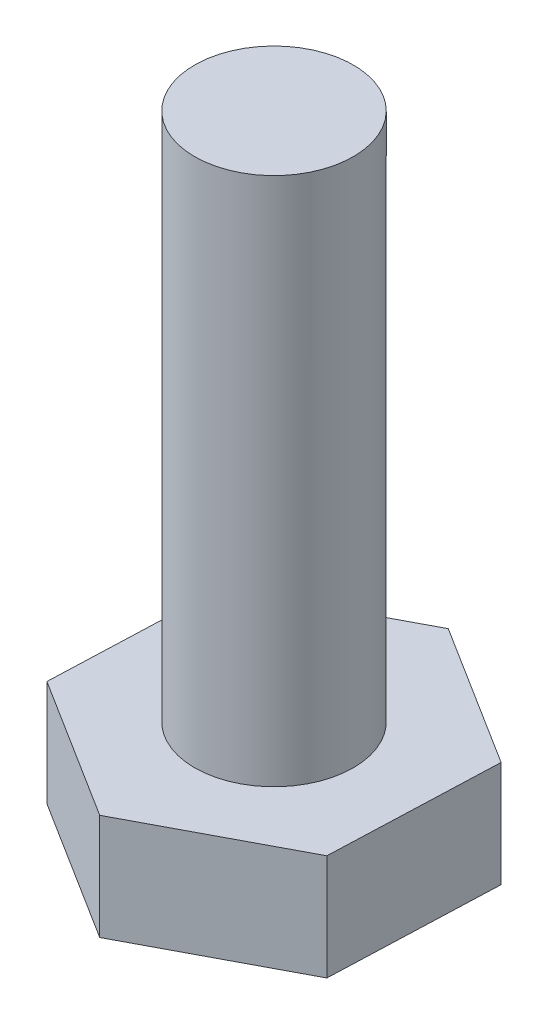
from build123d import *

# Parameters (mm, degrees)
BOSS_EXTRUDE1_DEPTH      = 8
BOSS_EXTRUDE1_DEPTH_BACK = 2
SKETCH1_R                = 1.5
SKETCH2_R                = 1.5
BOSS_EXTRUDE2_DEPTH      = 2
SKETCH5_R                = 1.5
BOSS_EXTRUDE3_DEPTH      = 2


with BuildPart() as part:
    # Sketch1 → Boss-Extrude1 (new, two sides: drawn at the far end of the back side and taken through both)
    with BuildSketch(Plane(origin=(0, 0, 0), x_dir=(1, 0, 0), z_dir=(0, 1, 0)).offset(-BOSS_EXTRUDE1_DEPTH_BACK)):
        with Locations(Location((-11.29860715, -4.069786589, 0), (0, 0, 270))):
            Circle(SKETCH1_R)
    extrude(amount=BOSS_EXTRUDE1_DEPTH + BOSS_EXTRUDE1_DEPTH_BACK)



with BuildPart() as body_2:
    # Sketch2 → Boss-Extrude2 (new body)
    with BuildSketch(Plane.XZ.offset(2)):
        Polygon((-14.106389898, 5.552921571), (-13.986931095, 2.379742892), (-11.179148348, 0.89660791), (-8.490824402, 2.586651607), (-8.610283205, 5.759830286), (-11.418065953, 7.242965268), align=None)
        with Locations(Location((-11.29860715, 4.069786589, 0), (0, 0, 90))):
            Circle(SKETCH2_R, mode=Mode.SUBTRACT)
    extrude(amount=BOSS_EXTRUDE2_DEPTH)


with BuildPart() as part_1:
    add(part.part)

    add(body_2.part)  # Boss-Extrude3 merges body 2
    # Sketch5 → Boss-Extrude3 (add)
    with BuildSketch(Plane.XZ.offset(4)):
        with Locations(Location((-11.29860715, 4.069786589, 0), (0, 0, 90))):
            Circle(SKETCH5_R)
    extrude(amount=-BOSS_EXTRUDE3_DEPTH)


solid = part_1.part
